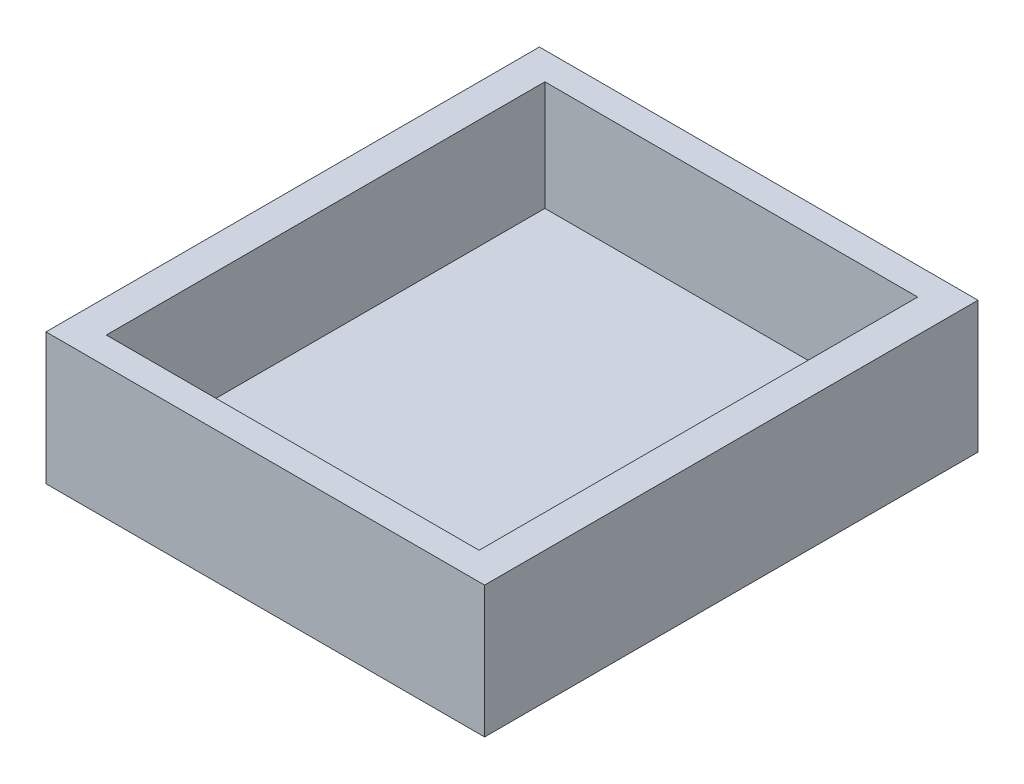
from build123d import *

# Parameters (mm, degrees)
SKETCH1_W           = 40
SKETCH1_H           = 45
BOSS_EXTRUDE1_DEPTH = 12
SKETCH2_W           = 34
SKETCH2_H           = 40
CUT_EXTRUDE1_DEPTH  = 10


with BuildPart() as part:
    # Sketch1 → Boss-Extrude1 (new body)
    with BuildSketch(Plane(origin=(0, 0, 0), x_dir=(1, 0, 0), z_dir=(0, 1, 0))):
        with Locations((20, 22.5)):
            Rectangle(SKETCH1_W, SKETCH1_H)
    extrude(amount=BOSS_EXTRUDE1_DEPTH)

    # Sketch2 → Cut-Extrude1 (cut)
    with BuildSketch(Plane(origin=(0, 12, 0), x_dir=(1, 0, 0), z_dir=(0, 1, 0))):
        with Locations((20, 22.5)):
            Rectangle(SKETCH2_W, SKETCH2_H)
    extrude(amount=-CUT_EXTRUDE1_DEPTH, mode=Mode.SUBTRACT)


solid = part.part
